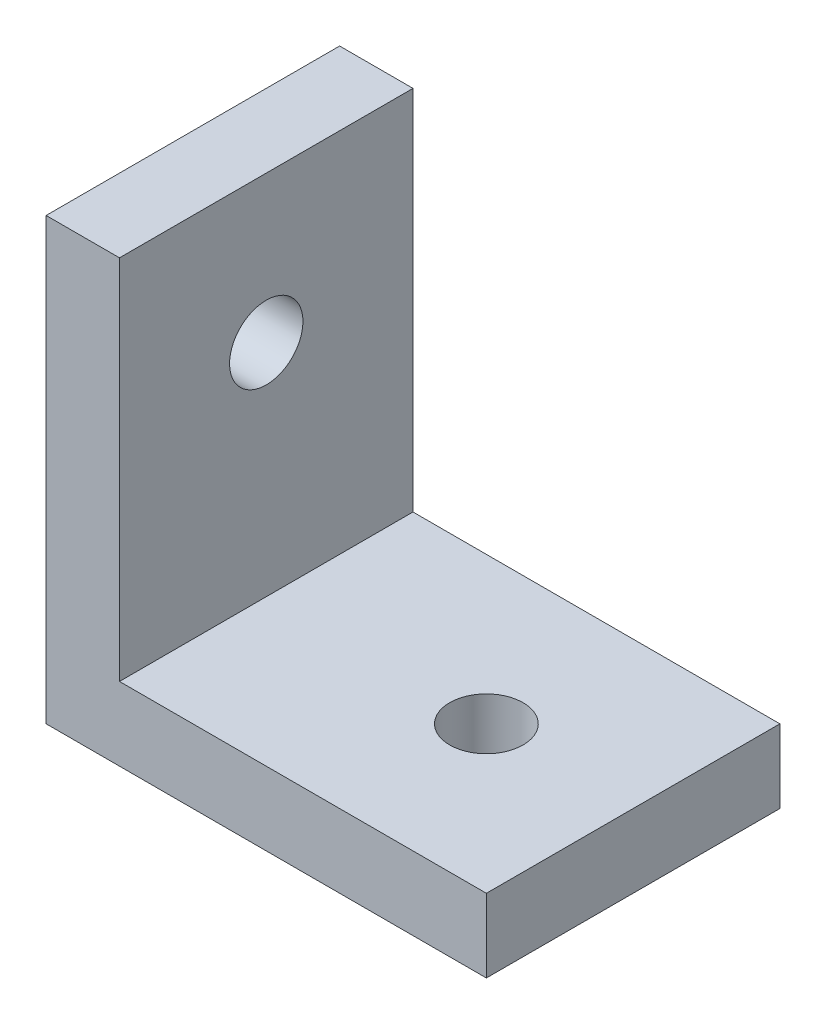
from build123d import *

# Parameters (mm, degrees)
BOSS_EXTRUDE1_DEPTH = 25.4
CUT_EXTRUDE1_REACH  = 57.721
SKETCH2_R           = 3.175
CUT_EXTRUDE2_REACH  = 53.588
SKETCH3_R           = 3.175


with BuildPart() as part:
    # Sketch1 → Boss-Extrude1 (new body)
    with BuildSketch(Plane.XY):
        Polygon((0, 0), (0, -31.75), (31.75, -31.75), (31.75, -38.1), (-6.35, -38.1), (-6.35, 0), align=None)
    extrude(amount=BOSS_EXTRUDE1_DEPTH)

    # Sketch2 → Cut-Extrude1 (cut, up to next)
    with BuildSketch(Plane(origin=(0, 0, 0), x_dir=(0, 0, -1), z_dir=(1, 0, 0)), mode=Mode.PRIVATE) as cut_extrude1_sk1:
        with Locations(Location((-12.7, -12.7, 0), (0, 0, 90))):
            Circle(SKETCH2_R)
    cut_extrude1_tool1 = extrude(cut_extrude1_sk1.sketch, amount=-CUT_EXTRUDE1_REACH, mode=Mode.PRIVATE) & part.part
    add(cut_extrude1_tool1.solids().sort_by_distance((0, -12.7, 12.7))[0], mode=Mode.SUBTRACT)

    # Sketch3 → Cut-Extrude2 (cut, up to next)
    with BuildSketch(Plane(origin=(0, -31.75, 0), x_dir=(1, 0, 0), z_dir=(0, 1, 0)), mode=Mode.PRIVATE) as cut_extrude2_sk1:
        with Locations(Location((19.05, -12.7, 0), (0, 0, 270))):
            Circle(SKETCH3_R)
    cut_extrude2_tool1 = extrude(cut_extrude2_sk1.sketch, amount=-CUT_EXTRUDE2_REACH, mode=Mode.PRIVATE) & part.part
    add(cut_extrude2_tool1.solids().sort_by_distance((19.05, -31.75, 12.7))[0], mode=Mode.SUBTRACT)


solid = part.part
